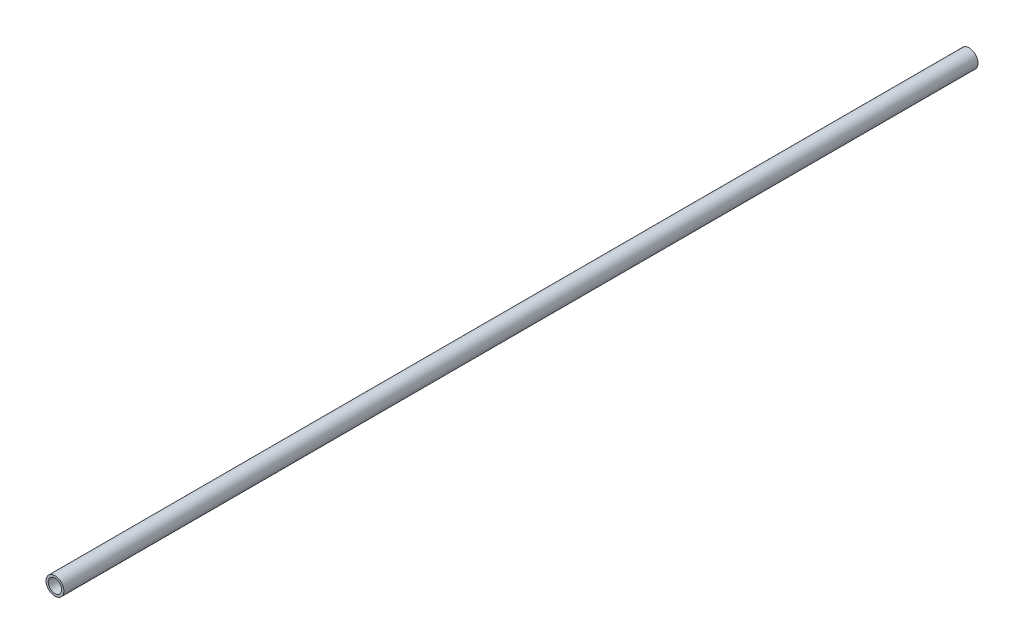
from build123d import *

# Parameters (mm, degrees)
ESQUISSE1_R        = 2
ESQUISSE1_R_2      = 1.5
EXTRU_MINCE1_DEPTH = 205


with BuildPart() as part:
    # Esquisse1 → Extru.-Mince1 (new body)
    with BuildSketch(Plane.XY):
        with Locations((0.753770009, 0)):
            Circle(ESQUISSE1_R)
        with Locations((0.753770009, 0)):
            Circle(ESQUISSE1_R_2, mode=Mode.SUBTRACT)
    extrude(amount=EXTRU_MINCE1_DEPTH)


solid = part.part
